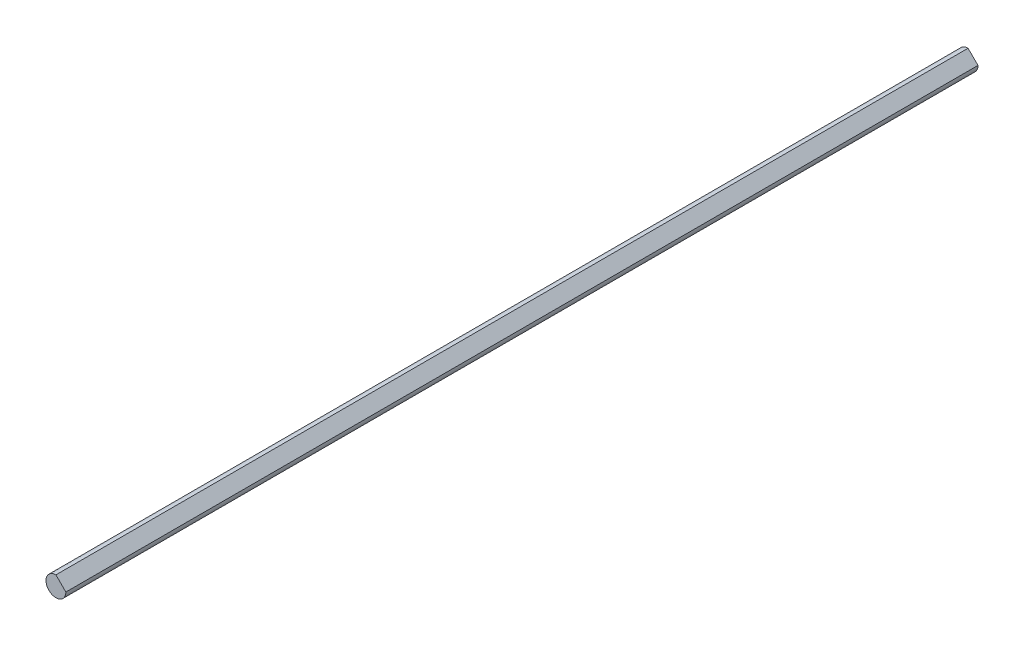
from build123d import *

# Parameters (mm, degrees)
BOSS_EXTRUDE1_DEPTH = 350


with BuildPart() as part:
    # Sketch1 → Boss-Extrude1 (new body)
    with BuildSketch(Plane.XY):
        with BuildLine():
            Line((0, 3.81), (3.81, 0))
            ThreePointArc((3.81, 0), (-2.694076836, -2.694076836), (0, 3.81))
        make_face()
    extrude(amount=BOSS_EXTRUDE1_DEPTH)


solid = part.part
